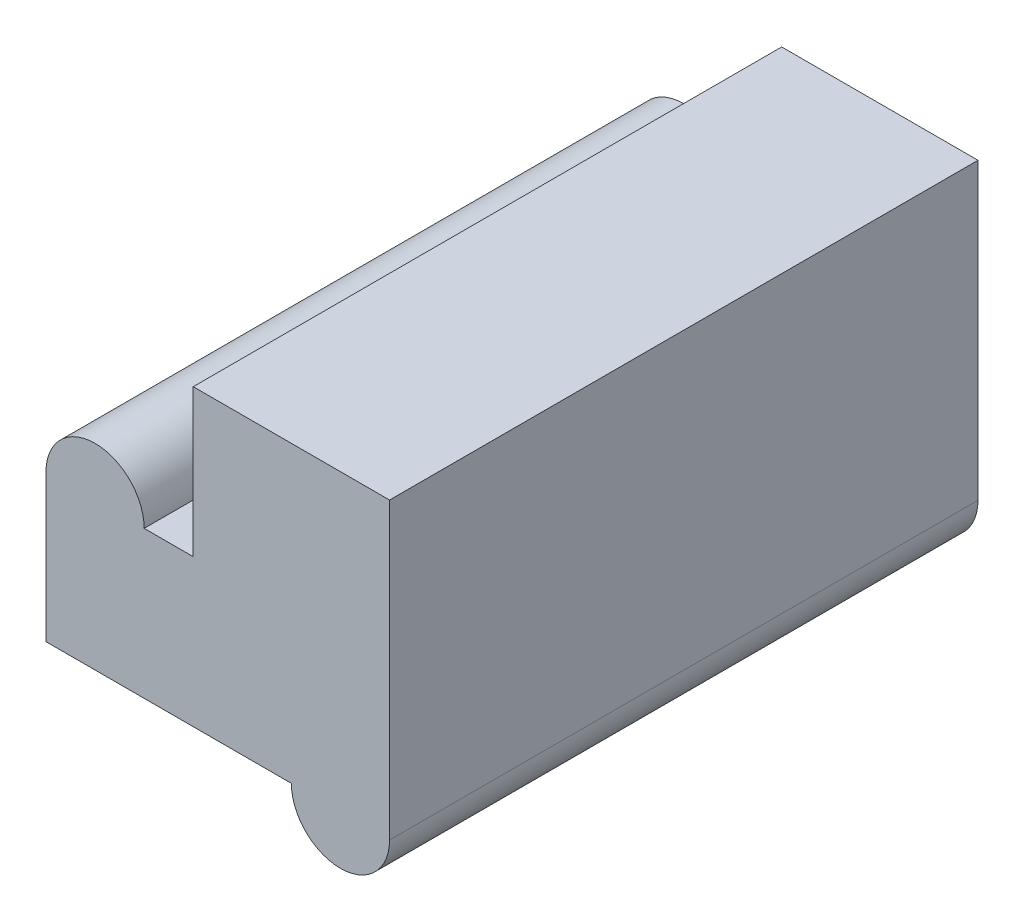
from build123d import *

# Parameters (mm, degrees)
BOSS_EXTRUDE1_DEPTH      = 140.208
BOSS_EXTRUDE1_DEPTH_BACK = 164.338


with BuildPart() as part:
    # First Part → Boss-Extrude1 (new, two sides: drawn at the far end of the back side and taken through both)
    with BuildSketch(Plane.XY.offset(-BOSS_EXTRUDE1_DEPTH_BACK)):
        with BuildLine():
            Line((0, 0), (0, 76.2))
            Line((0, 76.2), (101.6, 76.2))
            Line((101.6, 76.2), (101.6, -76.2))
            ThreePointArc((101.6, -76.2), (76.2, -101.6), (50.8, -76.2))
            Line((50.8, -76.2), (-76.2, -76.2))
            Line((-76.2, -76.2), (-76.2, 0))
            ThreePointArc((-76.2, 0), (-50.8, 25.4), (-25.4, 0))
            Line((-25.4, 0), (0, 0))
        make_face()
    extrude(amount=BOSS_EXTRUDE1_DEPTH + BOSS_EXTRUDE1_DEPTH_BACK)


solid = part.part
